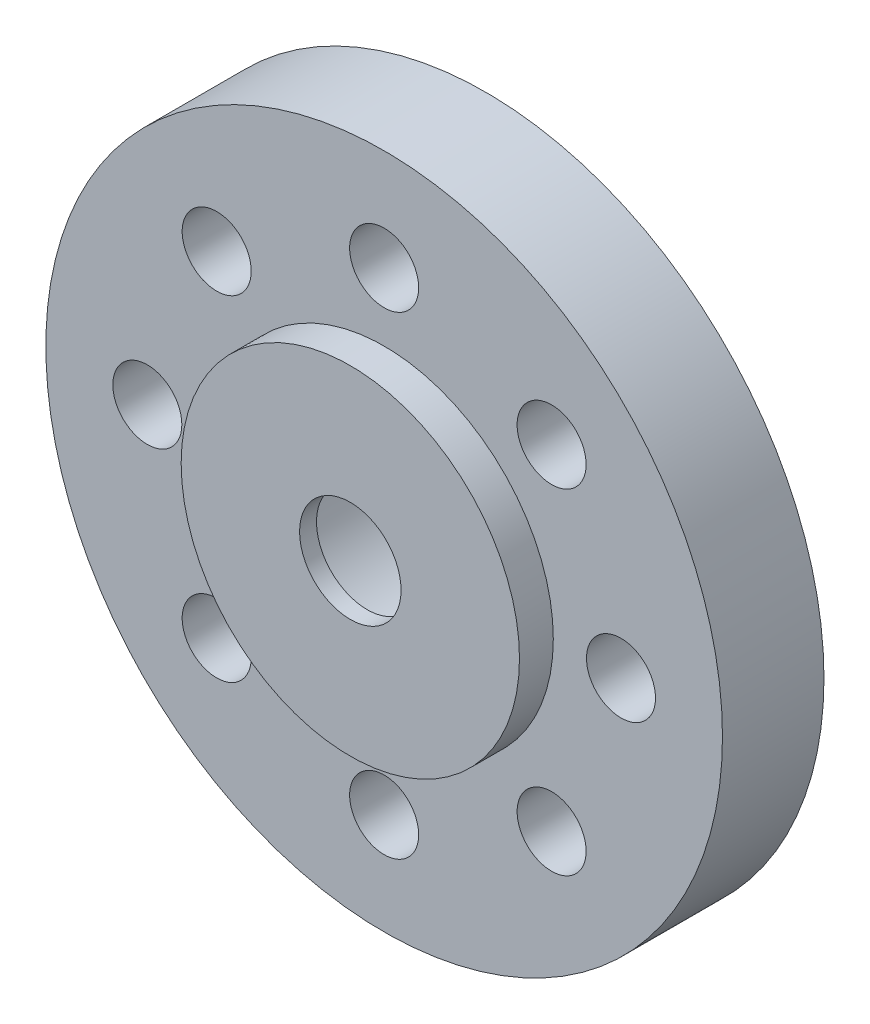
from build123d import *

# Parameters (mm, degrees)
SKETCH_1_R               = 10
SKETCH_1_R_2             = 1.02
SKETCH_1_R_3             = 1.5
EXTRUDE_1_DEPTH          = 3
SKETCH_2_R               = 5
EXTRUDE_2_DEPTH          = 1
CUT_EXTRUDE_1_DEPTH      = 10
CUT_EXTRUDE_1_DEPTH_BACK = 0.5
SKETCH_3_R               = 3
SKETCH_4_R               = 1.5
CUT_EXTRUDE_2_DEPTH      = 8.5


with BuildPart() as part:
    # ｽｹｯﾁ1 → ﾎﾞｽ - 押し出し1 (new body)
    with BuildSketch(Plane.XY):
        with Locations((-29.978703949, 66)):
            Circle(SKETCH_1_R)
        with Locations((-25.028956481, 61.050252532)):
            Circle(SKETCH_1_R_2, mode=Mode.SUBTRACT)
        with Locations((-29.978703949, 59)):
            Circle(SKETCH_1_R_2, mode=Mode.SUBTRACT)
        with Locations((-34.928451418, 61.050252532)):
            Circle(SKETCH_1_R_2, mode=Mode.SUBTRACT)
        with Locations((-36.978703949, 66)):
            Circle(SKETCH_1_R_2, mode=Mode.SUBTRACT)
        with Locations((-34.928451418, 70.949747468)):
            Circle(SKETCH_1_R_2, mode=Mode.SUBTRACT)
        with Locations((-29.978703949, 73)):
            Circle(SKETCH_1_R_2, mode=Mode.SUBTRACT)
        with Locations((-25.028956481, 70.949747468)):
            Circle(SKETCH_1_R_2, mode=Mode.SUBTRACT)
        with Locations((-22.978703949, 66)):
            Circle(SKETCH_1_R_2, mode=Mode.SUBTRACT)
        with Locations((-29.978703949, 66)):
            Circle(SKETCH_1_R_3, mode=Mode.SUBTRACT)
    extrude(amount=EXTRUDE_1_DEPTH)

    # ｽｹｯﾁ2 → ﾎﾞｽ - 押し出し2 (add)
    with BuildSketch(Plane.XY.offset(3)):
        with Locations((-29.978703949, 66)):
            Circle(SKETCH_2_R)
    extrude(amount=EXTRUDE_2_DEPTH)

    # ｽｹｯﾁ3 → ｶｯﾄ - 押し出し1 (cut, two sides: drawn at the far end of the back side and taken through both)
    with BuildSketch(Plane(origin=(0, 0, 3), x_dir=(-1, 0, 0), z_dir=(0, 0, -1)).offset(-CUT_EXTRUDE_1_DEPTH_BACK)):
        with Locations(Location((29.978703949, 66, 0), (0, 0, 180))):
            Circle(SKETCH_3_R)
    extrude(amount=CUT_EXTRUDE_1_DEPTH + CUT_EXTRUDE_1_DEPTH_BACK, mode=Mode.SUBTRACT)

    # ｽｹｯﾁ4 → ｶｯﾄ - 押し出し2 (cut)
    with BuildSketch(Plane(origin=(0, 0, 3.5), x_dir=(-1, 0, 0), z_dir=(0, 0, -1))):
        with Locations((29.978703949, 66)):
            Circle(SKETCH_4_R)
    extrude(amount=-CUT_EXTRUDE_2_DEPTH, mode=Mode.SUBTRACT)


solid = part.part
